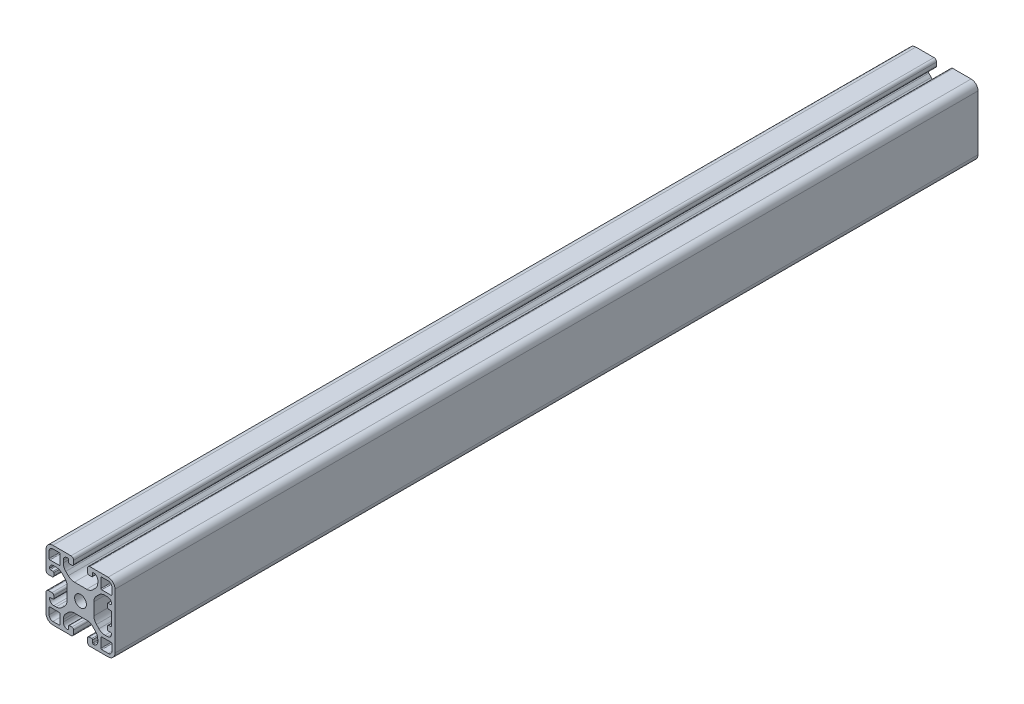
from build123d import *

# Parameters (mm, degrees)
SCHIZZO1_R                   = 3.4
ESTRUSIONE_ESTRUSIONE1_DEPTH = 500


with BuildPart() as part:
    # Schizzo1 → Estrusione-Estrusione1 (new body)
    with BuildSketch(Plane(origin=(0, 0, -340), x_dir=(-1, 0, 0), z_dir=(0, 0, -1))):
        with BuildLine():
            Line((6.5, -15.5), (5, -15.5))
            ThreePointArc((5, -15.5), (4.292893219, -15.792893219), (4, -16.5))
            Line((4, -16.5), (4, -18.5))
            ThreePointArc((4, -18.5), (4.439339828, -19.560660172), (5.5, -20))
            Line((5.5, -20), (16, -20))
            ThreePointArc((16, -20), (18.828427125, -18.828427125), (20, -16))
            Line((20, -16), (20, -5.5))
            ThreePointArc((20, -5.5), (19.560660172, -4.439339828), (18.5, -4))
            Line((18.5, -4), (16.5, -4))
            ThreePointArc((16.5, -4), (15.792893219, -4.292893219), (15.5, -5))
            Line((15.5, -5), (15.5, -6.5))
            ThreePointArc((15.5, -6.5), (15.646446609, -6.853553391), (16, -7))
            Line((16, -7), (17.55, -7))
            ThreePointArc((17.55, -7), (17.868198052, -7.131801948), (18, -7.45))
            Line((18, -7.45), (18, -7.5))
            ThreePointArc((18, -7.5), (17.267766953, -9.267766953), (15.5, -10))
            Line((15.5, -10), (14.192388155, -10))
            ThreePointArc((14.192388155, -10), (12.278970994, -9.619397663), (10.656854249, -8.535533906))
            Line((10.656854249, -8.535533906), (9.214466094, -7.09314575))
            ThreePointArc((9.214466094, -7.09314575), (8.130602337, -5.471029006), (7.75, -3.557611845))
            Line((7.75, -3.557611845), (7.75, 3.557611845))
            ThreePointArc((7.75, 3.557611845), (8.130602337, 5.471029006), (9.214466094, 7.09314575))
            Line((9.214466094, 7.09314575), (10.656854249, 8.535533906))
            ThreePointArc((10.656854249, 8.535533906), (12.278970994, 9.619397663), (14.192388155, 10))
            Line((14.192388155, 10), (15.5, 10))
            ThreePointArc((15.5, 10), (17.267766953, 9.267766953), (18, 7.5))
            Line((18, 7.5), (18, 7.45))
            ThreePointArc((18, 7.45), (17.868198052, 7.131801948), (17.55, 7))
            Line((17.55, 7), (16, 7))
            ThreePointArc((16, 7), (15.646446609, 6.853553391), (15.5, 6.5))
            Line((15.5, 6.5), (15.5, 5))
            ThreePointArc((15.5, 5), (15.792893219, 4.292893219), (16.5, 4))
            Line((16.5, 4), (18.5, 4))
            ThreePointArc((18.5, 4), (19.560660172, 4.439339828), (20, 5.5))
            Line((20, 5.5), (20, 16))
            ThreePointArc((20, 16), (18.828427125, 18.828427125), (16, 20))
            Line((16, 20), (5.5, 20))
            ThreePointArc((5.5, 20), (4.439339828, 19.560660172), (4, 18.5))
            Line((4, 18.5), (4, 16.5))
            ThreePointArc((4, 16.5), (4.292893219, 15.792893219), (5, 15.5))
            Line((5, 15.5), (6.5, 15.5))
            ThreePointArc((6.5, 15.5), (6.853553391, 15.646446609), (7, 16))
            Line((7, 16), (7, 17.55))
            ThreePointArc((7, 17.55), (7.131801948, 17.868198052), (7.45, 18))
            Line((7.45, 18), (7.5, 18))
            ThreePointArc((7.5, 18), (9.267766953, 17.267766953), (10, 15.5))
            Line((10, 15.5), (10, 14.192388155))
            ThreePointArc((10, 14.192388155), (9.619397663, 12.278970994), (8.535533906, 10.656854249))
            Line((8.535533906, 10.656854249), (7.09314575, 9.214466094))
            ThreePointArc((7.09314575, 9.214466094), (5.471029006, 8.130602337), (3.557611844, 7.75))
            Line((3.557611844, 7.75), (-3.557611845, 7.75))
            ThreePointArc((-3.557611845, 7.75), (-5.471029006, 8.130602337), (-7.09314575, 9.214466094))
            Line((-7.09314575, 9.214466094), (-8.535533906, 10.656854249))
            ThreePointArc((-8.535533906, 10.656854249), (-9.619397663, 12.278970994), (-10, 14.192388155))
            Line((-10, 14.192388155), (-10, 15.5))
            ThreePointArc((-10, 15.5), (-9.267766953, 17.267766953), (-7.5, 18))
            Line((-7.5, 18), (-7.45, 18))
            ThreePointArc((-7.45, 18), (-7.131801948, 17.868198052), (-7, 17.55))
            Line((-7, 17.55), (-7, 16))
            ThreePointArc((-7, 16), (-6.853553391, 15.646446609), (-6.5, 15.5))
            Line((-6.5, 15.5), (-5, 15.5))
            ThreePointArc((-5, 15.5), (-4.292893219, 15.792893219), (-4, 16.5))
            Line((-4, 16.5), (-4, 18.5))
            ThreePointArc((-4, 18.5), (-4.439339828, 19.560660172), (-5.5, 20))
            Line((-5.5, 20), (-16, 20))
            ThreePointArc((-16, 20), (-18.828427125, 18.828427125), (-20, 16))
            Line((-20, 16), (-20, -16))
            ThreePointArc((-20, -16), (-18.828427125, -18.828427125), (-16, -20))
            Line((-16, -20), (-5.5, -20))
            ThreePointArc((-5.5, -20), (-4.439339828, -19.560660172), (-4, -18.5))
            Line((-4, -18.5), (-4, -16.5))
            ThreePointArc((-4, -16.5), (-4.292893219, -15.792893219), (-5, -15.5))
            Line((-5, -15.5), (-6.5, -15.5))
            ThreePointArc((-6.5, -15.5), (-6.853553391, -15.646446609), (-7, -16))
            Line((-7, -16), (-7, -17.55))
            ThreePointArc((-7, -17.55), (-7.131801948, -17.868198052), (-7.45, -18))
            Line((-7.45, -18), (-7.5, -18))
            ThreePointArc((-7.5, -18), (-9.267766953, -17.267766953), (-10, -15.5))
            Line((-10, -15.5), (-10, -14.192388155))
            ThreePointArc((-10, -14.192388155), (-9.619397663, -12.278970994), (-8.535533906, -10.656854249))
            Line((-8.535533906, -10.656854249), (-7.09314575, -9.214466094))
            ThreePointArc((-7.09314575, -9.214466094), (-5.471029006, -8.130602337), (-3.557611845, -7.75))
            Line((-3.557611845, -7.75), (3.557611845, -7.75))
            ThreePointArc((3.557611845, -7.75), (5.471029006, -8.130602337), (7.09314575, -9.214466094))
            Line((7.09314575, -9.214466094), (8.535533906, -10.656854249))
            ThreePointArc((8.535533906, -10.656854249), (9.619397663, -12.278970994), (10, -14.192388155))
            Line((10, -14.192388155), (10, -15.5))
            ThreePointArc((10, -15.5), (9.267766953, -17.267766953), (7.5, -18))
            Line((7.5, -18), (7.45, -18))
            ThreePointArc((7.45, -18), (7.131801948, -17.868198052), (7, -17.55))
            Line((7, -17.55), (7, -16))
            ThreePointArc((7, -16), (6.853553391, -15.646446609), (6.5, -15.5))
        make_face()
        with Locations(Location((0, 0, 0), (0, 0, 180))):
            Circle(SCHIZZO1_R, mode=Mode.SUBTRACT)
        with BuildLine():
            Line((-12.3, -18.2), (-16, -18.2))
            ThreePointArc((-16, -18.2), (-17.555634919, -17.555634919), (-18.2, -16))
            Line((-18.2, -16), (-18.2, -12.3))
            ThreePointArc((-18.2, -12.3), (-18.053553391, -11.946446609), (-17.7, -11.8))
            Line((-17.7, -11.8), (-12.3, -11.8))
            ThreePointArc((-12.3, -11.8), (-11.946446609, -11.946446609), (-11.8, -12.3))
            Line((-11.8, -12.3), (-11.8, -17.7))
            ThreePointArc((-11.8, -17.7), (-11.946446609, -18.053553391), (-12.3, -18.2))
        make_face(mode=Mode.SUBTRACT)
        with BuildLine():
            Line((-11.8, 17.7), (-11.8, 12.3))
            ThreePointArc((-11.8, 12.3), (-11.946446609, 11.946446609), (-12.3, 11.8))
            Line((-12.3, 11.8), (-17.7, 11.8))
            ThreePointArc((-17.7, 11.8), (-18.053553391, 11.946446609), (-18.2, 12.3))
            Line((-18.2, 12.3), (-18.2, 16))
            ThreePointArc((-18.2, 16), (-17.555634919, 17.555634919), (-16, 18.2))
            Line((-16, 18.2), (-12.3, 18.2))
            ThreePointArc((-12.3, 18.2), (-11.946446609, 18.053553391), (-11.8, 17.7))
        make_face(mode=Mode.SUBTRACT)
        with BuildLine():
            Line((18.2, 16), (18.2, 12.3))
            ThreePointArc((18.2, 12.3), (18.053553391, 11.946446609), (17.7, 11.8))
            Line((17.7, 11.8), (12.3, 11.8))
            ThreePointArc((12.3, 11.8), (11.946446609, 11.946446609), (11.8, 12.3))
            Line((11.8, 12.3), (11.8, 17.7))
            ThreePointArc((11.8, 17.7), (11.946446609, 18.053553391), (12.3, 18.2))
            Line((12.3, 18.2), (16, 18.2))
            ThreePointArc((16, 18.2), (17.555634919, 17.555634919), (18.2, 16))
        make_face(mode=Mode.SUBTRACT)
        with BuildLine():
            Line((18.2, -12.3), (18.2, -16))
            ThreePointArc((18.2, -16), (17.555634919, -17.555634919), (16, -18.2))
            Line((16, -18.2), (12.3, -18.2))
            ThreePointArc((12.3, -18.2), (11.946446609, -18.053553391), (11.8, -17.7))
            Line((11.8, -17.7), (11.8, -12.3))
            ThreePointArc((11.8, -12.3), (11.946446609, -11.946446609), (12.3, -11.8))
            Line((12.3, -11.8), (17.7, -11.8))
            ThreePointArc((17.7, -11.8), (18.053553391, -11.946446609), (18.2, -12.3))
        make_face(mode=Mode.SUBTRACT)
        with BuildLine():
            Line((-16, 7), (-17.5, 7))
            ThreePointArc((-17.5, 7), (-17.853553391, 7.146446609), (-18, 7.5))
            ThreePointArc((-18, 7.5), (-17.267766953, 9.267766953), (-15.5, 10))
            Line((-15.5, 10), (-14.192388155, 10))
            ThreePointArc((-14.192388155, 10), (-12.278970994, 9.619397663), (-10.656854249, 8.535533906))
            Line((-10.656854249, 8.535533906), (-9.214466094, 7.093145751))
            ThreePointArc((-9.214466094, 7.093145751), (-8.130602337, 5.471029006), (-7.75, 3.557611845))
            Line((-7.75, 3.557611845), (-7.75, -3.557611845))
            ThreePointArc((-7.75, -3.557611845), (-8.130602337, -5.471029006), (-9.214466094, -7.093145751))
            Line((-9.214466094, -7.093145751), (-10.656854249, -8.535533906))
            ThreePointArc((-10.656854249, -8.535533906), (-12.278970994, -9.619397663), (-14.192388155, -10))
            Line((-14.192388155, -10), (-15.5, -10))
            ThreePointArc((-15.5, -10), (-17.267766953, -9.267766953), (-18, -7.5))
            ThreePointArc((-18, -7.5), (-17.853553391, -7.146446609), (-17.5, -7))
            Line((-17.5, -7), (-16, -7))
            ThreePointArc((-16, -7), (-15.646446609, -6.853553391), (-15.5, -6.5))
            Line((-15.5, -6.5), (-15.5, -5))
            ThreePointArc((-15.5, -5), (-15.792893219, -4.292893219), (-16.5, -4))
            Line((-16.5, -4), (-17.5, -4))
            ThreePointArc((-17.5, -4), (-17.853553391, -3.853553391), (-18, -3.5))
            Line((-18, -3.5), (-18, 3.5))
            ThreePointArc((-18, 3.5), (-17.853553391, 3.853553391), (-17.5, 4))
            Line((-17.5, 4), (-16.5, 4))
            ThreePointArc((-16.5, 4), (-15.792893219, 4.292893219), (-15.5, 5))
            Line((-15.5, 5), (-15.5, 6.5))
            ThreePointArc((-15.5, 6.5), (-15.646446609, 6.853553391), (-16, 7))
        make_face(mode=Mode.SUBTRACT)
    extrude(amount=-ESTRUSIONE_ESTRUSIONE1_DEPTH)


solid = part.part
